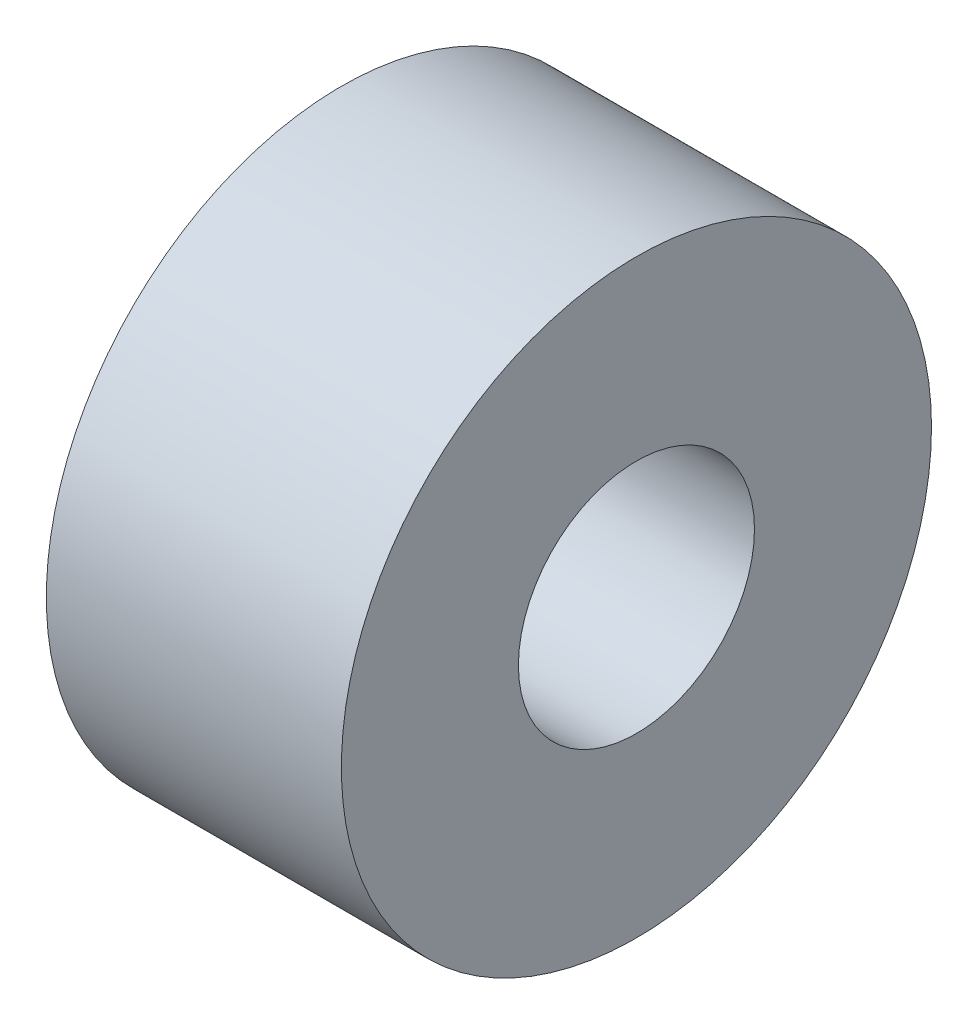
from build123d import *

# Parameters (mm, degrees)
ESBO_O1_R                = 2.5
ESBO_O1_R_2              = 1
RESSALTO_EXTRUS_O1_DEPTH = 2.5


with BuildPart() as part:
    # Esboço1 → Ressalto-extrusão1 (new body)
    with BuildSketch(Plane(origin=(0, 0, 0), x_dir=(0, 0, -1), z_dir=(1, 0, 0))):
        Circle(ESBO_O1_R)
        Circle(ESBO_O1_R_2, mode=Mode.SUBTRACT)
    extrude(amount=RESSALTO_EXTRUS_O1_DEPTH)


solid = part.part
